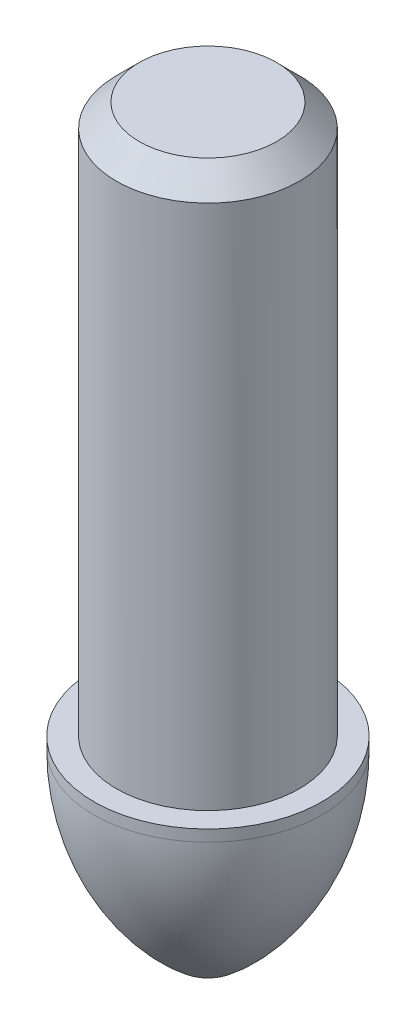
from build123d import *

# Parameters (mm, degrees)
CHAMFER1_SIZE = 1


with BuildPart() as part:
    # Sketch1 → Revolve1 (revolve)
    with BuildSketch(Plane.XY, mode=Mode.PRIVATE) as revolve1_sk:
        with BuildLine():
            Line((0, 0), (4, 0))
            Line((4, 0), (4, -24))
            Line((4, -24), (4.985, -24))
            Line((4.985, -24), (4.985, -24.5))
            ThreePointArc((4.985, -24.5), (4.003137517, -28.814427421), (1.250941029, -32.279070605))
            ThreePointArc((1.250941029, -32.279070605), (0.662951274, -32.605502555), (0, -32.718574998))
            Line((0, -32.718574998), (0, 0))
        make_face()
    revolve(revolve1_sk.sketch.rotate(Axis((0, 0, 0), (0, -1, 0)), 180), axis=Axis((0, 0, 0), (0, -1, 0)))

    # Chamfer1
    chamfer1_edges = [part.edges().sort_by_distance(p)[0] for p in [
        (4, 0, 0),
    ]]
    chamfer(chamfer1_edges, length=CHAMFER1_SIZE)


solid = part.part
